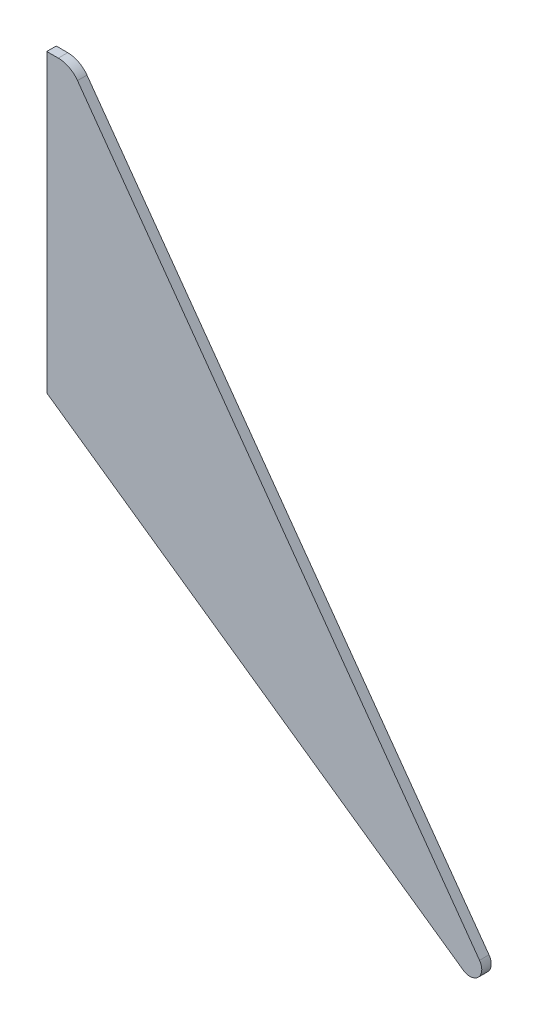
from build123d import *

# Parameters (mm, degrees)
EXTRUDE_1_DEPTH = 4
FILLET_1_R      = 5
FILLET_2_R      = 10


with BuildPart() as part:
    # Эскиз1 → Бобышка-Вытянуть1 (new body)
    with BuildSketch(Plane.XY):
        Polygon((0, 0), (0, 125), (10, 125), (200, -140.041507642), align=None)
    extrude(amount=EXTRUDE_1_DEPTH)

    # Скругление1
    fillet_1_edges = [part.edges().sort_by_distance(p)[0] for p in [
        (200, -140.041507642, 2),
    ]]
    fillet(fillet_1_edges, radius=FILLET_1_R)

    # Скругление2
    fillet_2_edges = [part.edges().sort_by_distance(p)[0] for p in [
        (10, 125, 2),
    ]]
    fillet(fillet_2_edges, radius=FILLET_2_R)


solid = part.part
